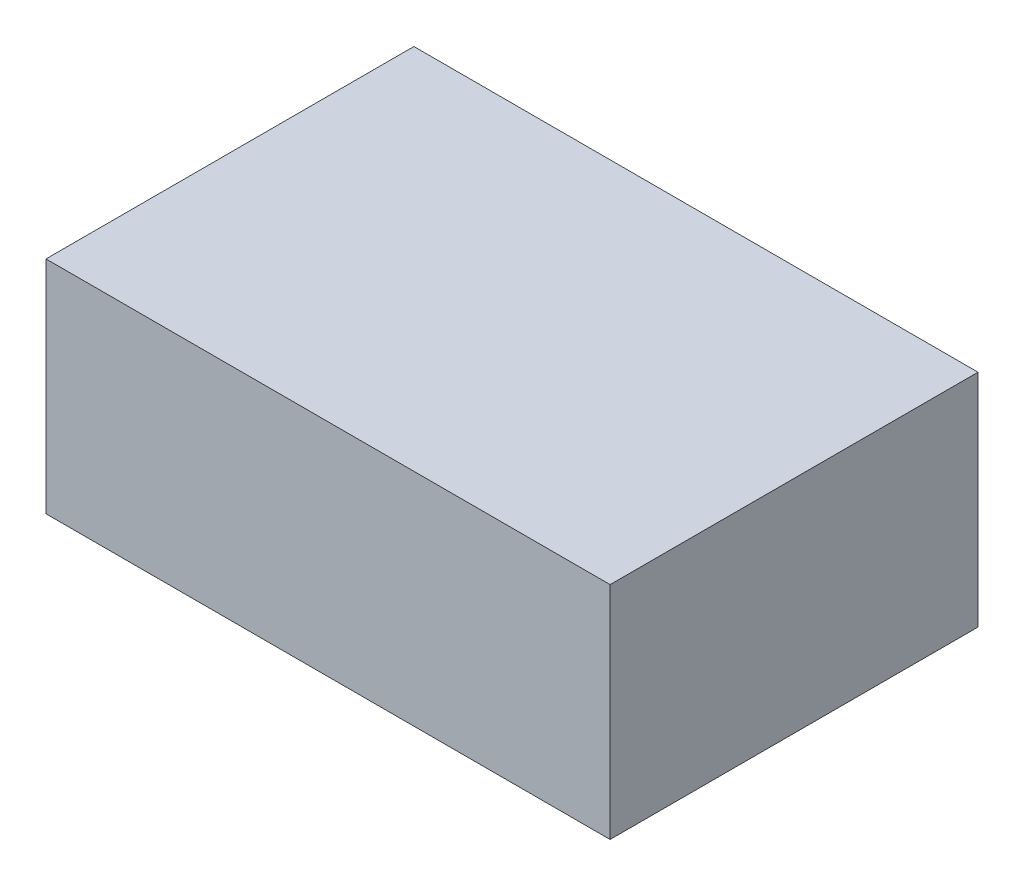
from build123d import *

# Parameters (mm, degrees)
SKETCH1_W           = 115
SKETCH1_H           = 75
BOSS_EXTRUDE2_DEPTH = 45


with BuildPart() as part:
    # Sketch1 → Boss-Extrude2 (new body)
    with BuildSketch(Plane(origin=(0, 0, 0), x_dir=(1, 0, 0), z_dir=(0, 1, 0))):
        with Locations((5.992957746, -10.450704225)):
            Rectangle(SKETCH1_W, SKETCH1_H)
    extrude(amount=BOSS_EXTRUDE2_DEPTH)


solid = part.part
